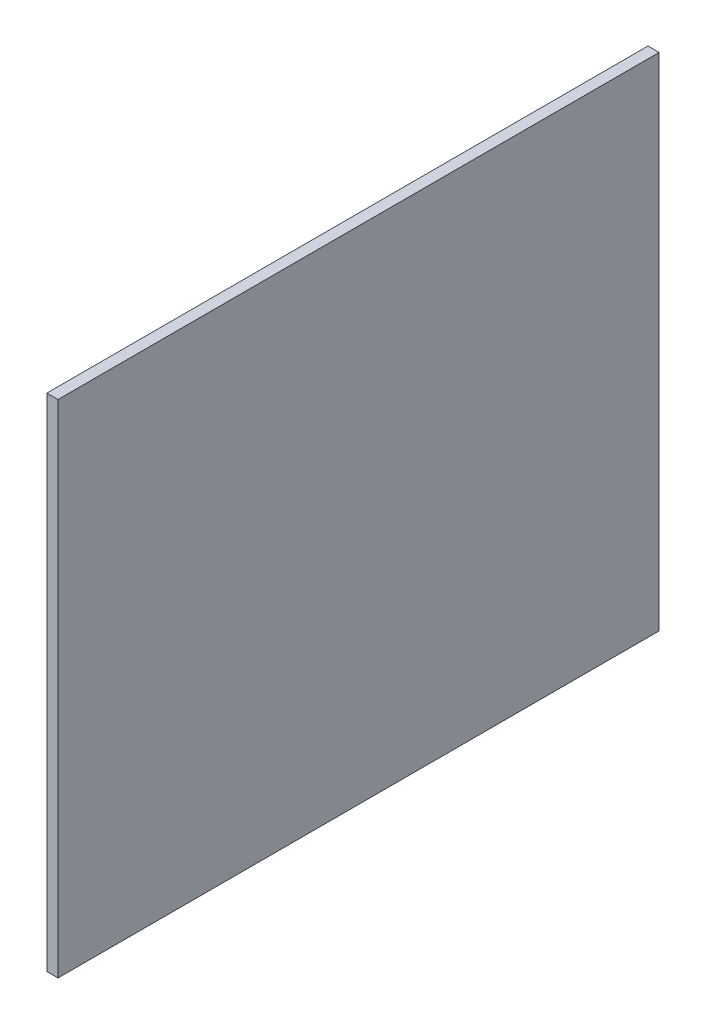
from build123d import *

# Parameters (mm, degrees)
SKETCH1_W           = 432
SKETCH1_H           = 360
BOSS_EXTRUDE1_DEPTH = 8


with BuildPart() as part:
    # Sketch1 → Boss-Extrude1 (new body)
    with BuildSketch(Plane(origin=(0, 0, 0), x_dir=(0, 0, -1), z_dir=(1, 0, 0))):
        with Locations((216, 180)):
            Rectangle(SKETCH1_W, SKETCH1_H)
    extrude(amount=BOSS_EXTRUDE1_DEPTH)


solid = part.part
